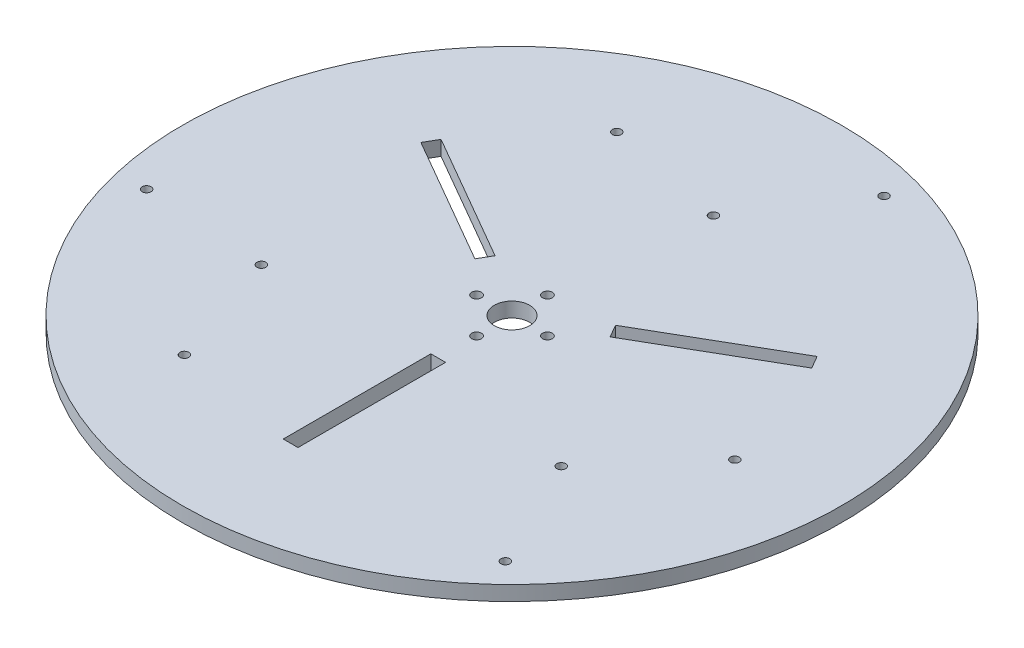
from build123d import *

# Parameters (mm, degrees)
SKETCH_1_R               = 6
EXTRUDE_1_DEPTH          = 5
CUT_EXTRUDE_1_DEPTH      = 142.435598161
CUT_EXTRUDE_1_DEPTH_BACK = 142.435598161
SKETCH_5_W               = 5
SKETCH_5_H               = 50
SKETCH_6_R               = 111.64768953
EXTRUDE_4_DEPTH          = 5
F_3_0MM_1_D              = 3
PATTERN_CIRCULAR_1_COUNT = 3
HOLE_WIZARD_M4_1_D       = 3.3


with BuildPart() as part:
    # 草圖1 → 填料-伸長1 (new body)
    with BuildSketch(Plane(origin=(0, 0, 0), x_dir=(1, 0, 0), z_dir=(0, 1, 0))):
        with BuildLine():
            ThreePointArc((-54.140127389, 84.076433121), (-86.602540378, 50), (-99.882390637, 4.848509122))
            ThreePointArc((-99.882390637, 4.848509122), (-94.722486108, -4.890404948), (-83.701905284, -5.024047358))
            ThreePointArc((-83.701905284, -5.024047358), (-32.475952642, -18.75), (-46.201905284, -69.975952642))
            ThreePointArc((-46.201905284, -69.975952642), (-51.596457973, -79.586876805), (-45.742263248, -88.924942243))
            ThreePointArc((-45.742263248, -88.924942243), (0, -100), (45.742263248, -88.924942243))
            ThreePointArc((45.742263248, -88.924942243), (51.596457973, -79.586876805), (46.201905284, -69.975952642))
            ThreePointArc((46.201905284, -69.975952642), (32.475952642, -18.75), (83.701905284, -5.024047358))
            ThreePointArc((83.701905284, -5.024047358), (94.722486108, -4.890404948), (99.882390637, 4.848509122))
            ThreePointArc((99.882390637, 4.848509122), (86.602540378, 50), (54.140127389, 84.076433121))
            ThreePointArc((54.140127389, 84.076433121), (43.126028135, 84.477281753), (37.5, 75))
            ThreePointArc((37.5, 75), (0, 37.5), (-37.5, 75))
            ThreePointArc((-37.5, 75), (-43.126028135, 84.477281753), (-54.140127389, 84.076433121))
        make_face()
        with Locations(Location((0, 0, 0), (0, 0, 270))):
            Circle(SKETCH_1_R, mode=Mode.SUBTRACT)
    extrude(amount=-EXTRUDE_1_DEPTH)

    # 草圖5 → 除料-伸長1 (cut, two sides: drawn at the far end of the back side and taken through both)
    with BuildSketch(Plane(origin=(0, 0, 0), x_dir=(1, 0, 0), z_dir=(0, 1, 0)).offset(-CUT_EXTRUDE_1_DEPTH_BACK)):
        with BuildLine():
            ThreePointArc((18.659757868, -98.243643236), (-14.320442433, -98.969313065), (-45.742263248, -88.924942243))
            ThreePointArc((-45.742263248, -88.924942243), (-51.596457973, -79.586876805), (-46.201905284, -69.975952642))
            ThreePointArc((-46.201905284, -69.975952642), (-35.201155023, -60.328553588), (-28.729686798, -47.205714191))
            ThreePointArc((-28.729686798, -47.205714191), (-19.144613028, -85.825688538), (18.659757868, -98.243643236))
        make_face()
        with BuildLine():
            ThreePointArc((75.751611869, 65.28164596), (92.870160526, 37.082789592), (99.882390637, 4.848509122))
            ThreePointArc((99.882390637, 4.848509122), (94.722486108, -4.890404948), (83.701905284, -5.024047358))
            ThreePointArc((83.701905284, -5.024047358), (69.846637492, -0.320817698), (55.246191092, -1.277781514))
            ThreePointArc((55.246191092, -1.277781514), (83.899533086, 26.333123041), (75.751611869, 65.28164596))
        make_face()
        Polygon((-20.400635095, 14.665063509), (-22.900635095, 10.334936491), (-66.201905284, 35.334936491), (-63.701905284, 39.665063509), align=None)
        with Locations((0, -50)):
            Rectangle(SKETCH_5_W, SKETCH_5_H)
        Polygon((22.900635095, 10.334936491), (20.400635095, 14.665063509), (63.701905284, 39.665063509), (66.201905284, 35.334936491), align=None)
        with BuildLine():
            ThreePointArc((-37.5, 75), (-34.645482469, 60.649371286), (-26.516504294, 48.483495706))
            ThreePointArc((-26.516504294, 48.483495706), (-64.754920057, 59.492565497), (-94.411369737, 32.961997276))
            ThreePointArc((-94.411369737, 32.961997276), (-78.549718093, 61.886523473), (-54.140127389, 84.076433121))
            ThreePointArc((-54.140127389, 84.076433121), (-43.126028135, 84.477281753), (-37.5, 75))
        make_face()
    extrude(amount=CUT_EXTRUDE_1_DEPTH + CUT_EXTRUDE_1_DEPTH_BACK, mode=Mode.SUBTRACT)

    # 草圖6 → 填料-伸長4 (add)
    # profile 1 of 2: a face of its own
    with BuildSketch(Plane(origin=(0, 0, 0), x_dir=(1, 0, 0), z_dir=(0, 1, 0))):
        with Locations(Location((0, 0, 0), (0, 0, 270))):
            Circle(SKETCH_6_R)
        with BuildLine():
            Line((-64.951905284, -37.5), (-28.729686798, -47.205714191))
            ThreePointArc((-28.729686798, -47.205714191), (-19.144613028, -85.825688538), (18.659757868, -98.243643236))
            ThreePointArc((18.659757868, -98.243643236), (32.536358555, -94.558898957), (45.742263248, -88.924942243))
            ThreePointArc((45.742263248, -88.924942243), (51.596457973, -79.586876805), (46.201905284, -69.975952642))
            ThreePointArc((46.201905284, -69.975952642), (27.772722982, -32.605267792), (55.246191092, -1.277781514))
            ThreePointArc((55.246191092, -1.277781514), (83.899533086, 26.333123041), (75.751611869, 65.28164596))
            ThreePointArc((75.751611869, 65.28164596), (65.622229374, 75.456762534), (54.140127389, 84.076433121))
            ThreePointArc((54.140127389, 84.076433121), (43.126028135, 84.477281753), (37.5, 75))
            ThreePointArc((37.5, 75), (14.350628714, 40.354517531), (-26.516504294, 48.483495706))
            ThreePointArc((-26.516504294, 48.483495706), (-64.754920057, 59.492565497), (-94.411369737, 32.961997276))
            ThreePointArc((-94.411369737, 32.961997276), (-98.158587928, 19.102136424), (-99.882390637, 4.848509122))
            ThreePointArc((-99.882390637, 4.848509122), (-94.722486108, -4.890404948), (-83.701905284, -5.024047358))
            Line((-83.701905284, -5.024047358), (-64.951905284, -37.5))
        make_face(mode=Mode.SUBTRACT)
    # profile 2 of 2: a face of its own
    with BuildSketch(Plane(origin=(0, 0, 0), x_dir=(1, 0, 0), z_dir=(0, 1, 0))):
        with BuildLine():
            Line((-83.701905284, -5.024047358), (-64.951905284, -37.5))
            Line((-64.951905284, -37.5), (-28.729686798, -47.205714191))
            ThreePointArc((-28.729686798, -47.205714191), (-42.123351696, -7.749249739), (-83.701905284, -5.024047358))
        make_face()
    extrude(amount=-EXTRUDE_4_DEPTH)

    # Ø3.0mm 定位孔1 (through all)
    with Locations(Plane(origin=(0, 0, 0), x_dir=(1, 0, 0), z_dir=(0, 1, 0))):
        with Locations((-43.948722523, -67.039547699), (-57.342387421, -27.583083246), (-98.920941009, -24.857880865)):
            f_3_0mm_1 = Hole(F_3_0MM_1_D / 2)

    # 環狀複製排列1: Ø3.0mm 定位孔1 ×3 about axis
    pattern_circular_1_axis = Axis((0, 0, 0), (0, 1, 0))
    for i in range(1, PATTERN_CIRCULAR_1_COUNT):
        add(f_3_0mm_1.rotate(pattern_circular_1_axis, i * 360 / PATTERN_CIRCULAR_1_COUNT), mode=Mode.SUBTRACT)

    # M4 螺紋孔1 (through all)
    with Locations(Plane(origin=(0, 0, 0), x_dir=(1, 0, 0), z_dir=(0, 1, 0))):
        with Locations((0, 12), (12, 0), (0, -12), (-12, 0)):
            Hole(HOLE_WIZARD_M4_1_D / 2)


solid = part.part
